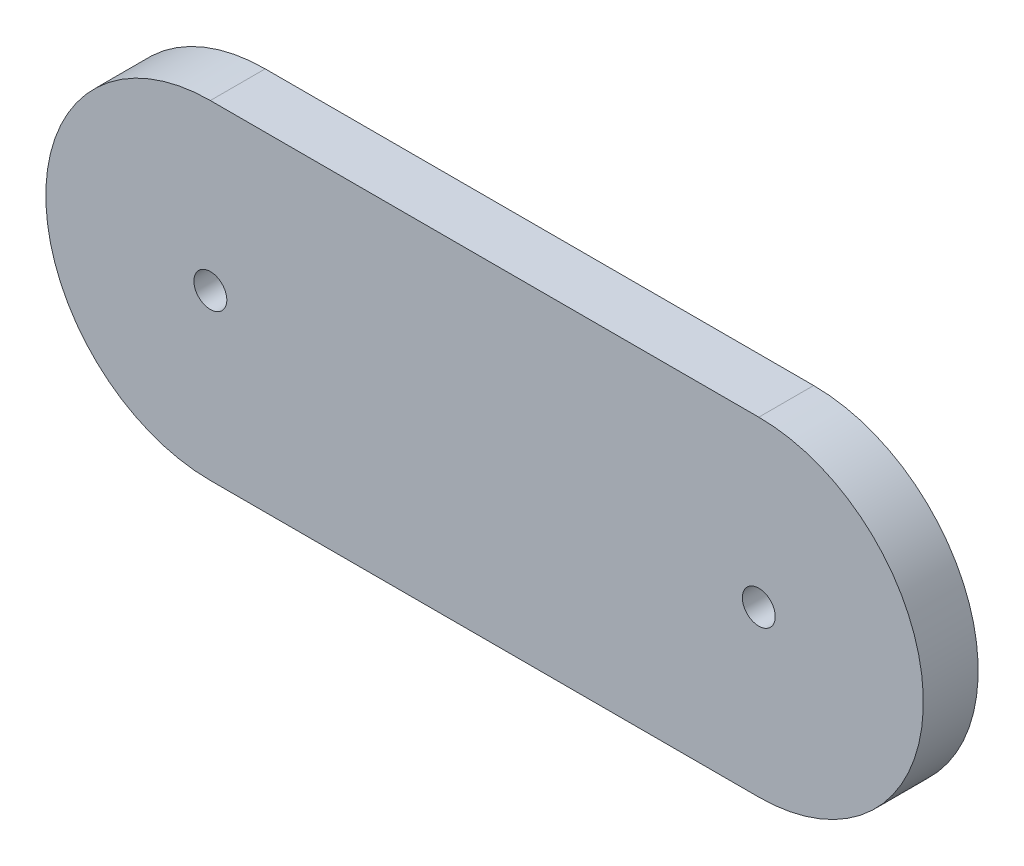
from build123d import *

# Parameters (mm, degrees)
BOSS_EXTRUDE1_DEPTH = 5
SKETCH3_R           = 1.5
CUT_EXTRUDE1_DEPTH  = 5


with BuildPart() as part:
    # Sketch2 → Boss-Extrude1 (new body)
    with BuildSketch(Plane.XY):
        with BuildLine():
            Line((0, 15), (50, 15))
            ThreePointArc((50, 15), (65, 0), (50, -15))
            Line((50, -15), (0, -15))
            ThreePointArc((0, -15), (-15, 0), (0, 15))
        make_face()
    extrude(amount=BOSS_EXTRUDE1_DEPTH)

    # Sketch3 → Cut-Extrude1 (cut)
    with BuildSketch(Plane(origin=(0, 0, 0), x_dir=(-1, 0, 0), z_dir=(0, 0, -1))):
        with Locations((-50, 0)):
            Circle(SKETCH3_R)
        Circle(SKETCH3_R)
    extrude(amount=-CUT_EXTRUDE1_DEPTH, mode=Mode.SUBTRACT)


solid = part.part
